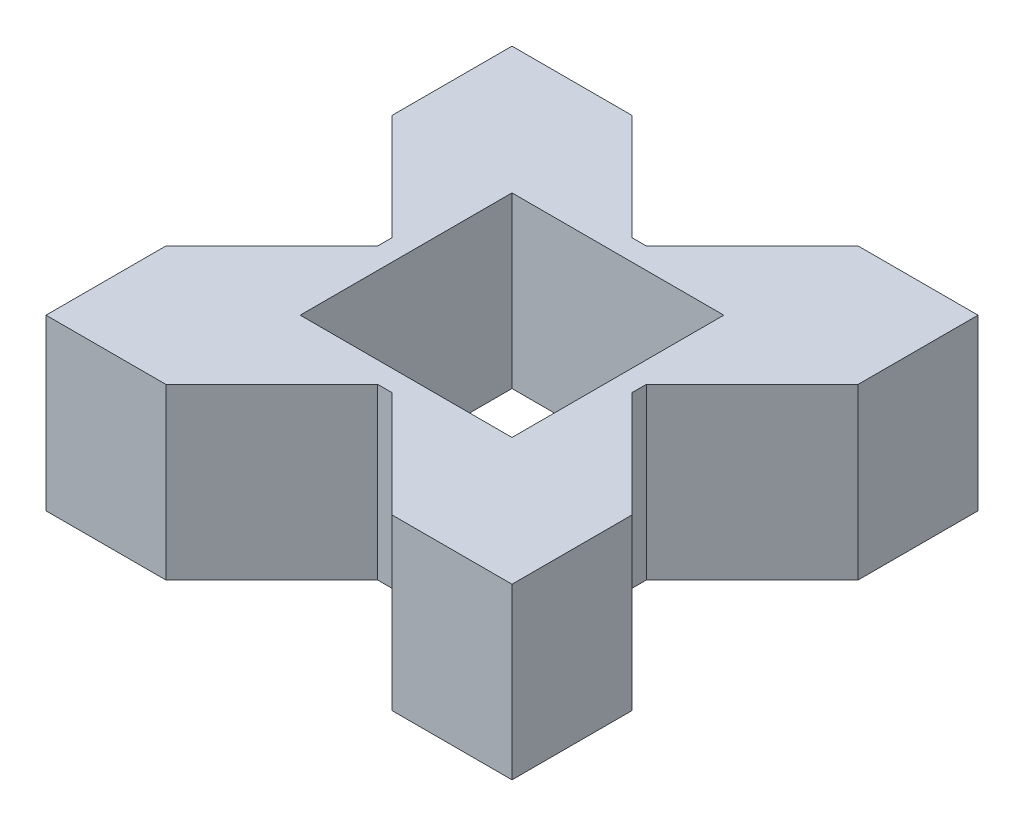
from build123d import *

# Parameters (mm, degrees)
BOSS_EXTRUDE1_DEPTH = 20
SKETCH2_W           = 25
SKETCH2_H           = 25
CUT_EXTRUDE2_DEPTH  = 44.732139211


with BuildPart() as part:
    # Sketch1 → Boss-Extrude1 (new body)
    with BuildSketch(Plane(origin=(0, 0, 0), x_dir=(1, 0, 0), z_dir=(0, 1, 0))):
        Polygon((27.5, -27.5), (27.5, -13.357864376), (15, -0.857864376), (15, 0.857864376), (27.5, 13.357864376), (27.5, 27.5), (13.357864376, 27.5), (0.857864376, 15), (-0.857864376, 15), (-13.357864376, 27.5), (-27.5, 27.5), (-27.5, 13.357864376), (-15, 0.857864376), (-15, -0.857864376), (-27.5, -13.357864376), (-27.5, -27.5), (-13.357864376, -27.5), (-0.857864376, -15), (0.857864376, -15), (13.357864376, -27.5), align=None)
    extrude(amount=BOSS_EXTRUDE1_DEPTH)

    # Sketch2 → Cut-Extrude2 (cut, through all)
    with BuildSketch(Plane(origin=(0, 20, 0), x_dir=(1, 0, 0), z_dir=(0, 1, 0))):
        Rectangle(SKETCH2_W, SKETCH2_H)
    extrude(amount=-CUT_EXTRUDE2_DEPTH, mode=Mode.SUBTRACT)


solid = part.part
